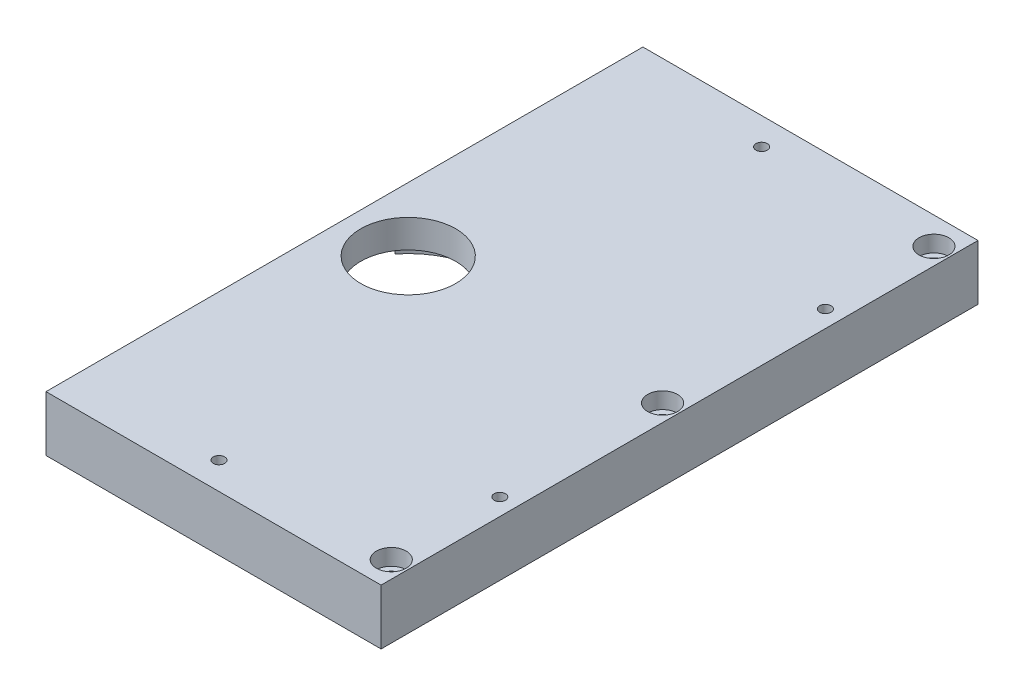
from build123d import *

# Parameters (mm, degrees)
SKETCH1_W                       = 123.5
SKETCH1_H                       = 220
BLOCO_DEPTH                     = 20.4
SKETCH2_R                       = 17.5
FURO_35_PASSANTE_DEPTH          = 254.117383836
SKETCH2_4_R                     = 30
SKETCH2_4_R_2                   = 17.5
REBAIXO_60X10_DEPTH             = 10
REBAIXO_M6_PASSANTE_D           = 6.6
REBAIXO_M6_PASSANTE_CBORE_D     = 11
REBAIXO_M6_PASSANTE_CBORE_DEPTH = 6
FURO_M5X0_8_PASSANTE_D          = 4.2


with BuildPart() as part:
    # Sketch1 → Bloco (new body)
    with BuildSketch(Plane(origin=(0, 0, 0), x_dir=(1, 0, 0), z_dir=(0, 1, 0))):
        with Locations((61.75, 110)):
            Rectangle(SKETCH1_W, SKETCH1_H)
    extrude(amount=-BLOCO_DEPTH)

    # Sketch2 → Furo Ø35 Passante (cut, through all)
    with BuildSketch(Plane(origin=(0, -20.4, 0), x_dir=(-1, 0, 0), z_dir=(0, -1, 0))):
        with Locations((-23.5, 110)):
            Circle(SKETCH2_R)
    extrude(amount=-FURO_35_PASSANTE_DEPTH, mode=Mode.SUBTRACT)

    # Sketch2<4> → Rebaixo Ø60x10 (cut)
    with BuildSketch(Plane(origin=(0, -20.4, 0), x_dir=(-1, 0, 0), z_dir=(0, -1, 0))):
        with Locations((-23.5, 110)):
            Circle(SKETCH2_4_R)
        with Locations((-23.5, 110)):
            Circle(SKETCH2_4_R_2, mode=Mode.SUBTRACT)
    extrude(amount=-REBAIXO_60X10_DEPTH, mode=Mode.SUBTRACT)

    # Rebaixo M6 - Passante (through all)
    with Locations(Plane(origin=(0, 0, 0), x_dir=(1, 0, 0), z_dir=(0, 1, 0))):
        with Locations((117.25, 10), (117.25, 110), (117.25, 210)):
            CounterBoreHole(REBAIXO_M6_PASSANTE_D / 2, REBAIXO_M6_PASSANTE_CBORE_D / 2, REBAIXO_M6_PASSANTE_CBORE_DEPTH)

    # Furo M5x0.8 - Passante (through all)
    with Locations(Plane(origin=(0, 0, 0), x_dir=(1, 0, 0), z_dir=(0, 1, 0))):
        with Locations((53.75, 10), (117.25, 50), (117.25, 170), (53.75, 210)):
            Hole(FURO_M5X0_8_PASSANTE_D / 2)


solid = part.part
